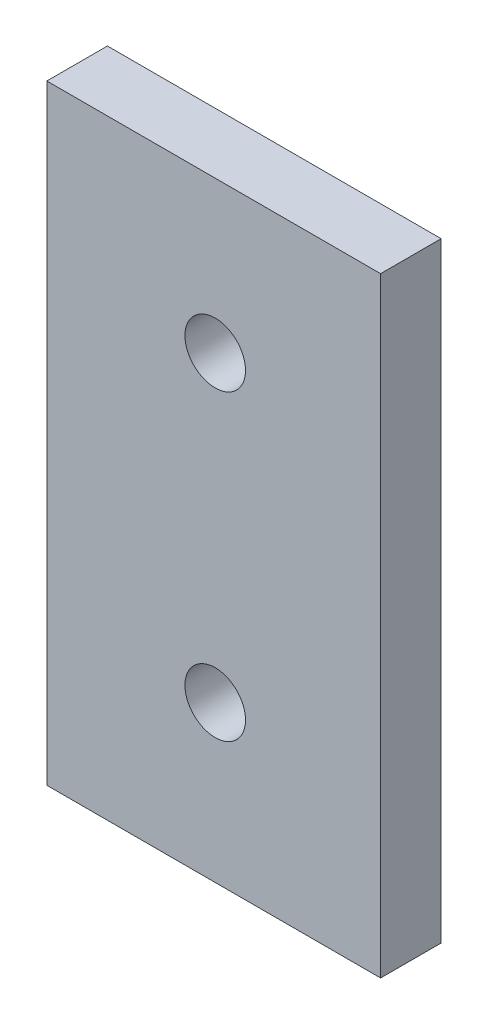
from build123d import *

# Parameters (mm, degrees)
SKETCH1_W           = 11.021644678
SKETCH1_H           = 20.145068856
SKETCH1_R           = 1
BOSS_EXTRUDE1_DEPTH = 2


with BuildPart() as part:
    # Sketch1 → Boss-Extrude1 (new body)
    with BuildSketch(Plane.XY):
        with Locations((5.510822339, 10.072534428)):
            Rectangle(SKETCH1_W, SKETCH1_H)
        with Locations((5.56, 15.145068856)):
            Circle(SKETCH1_R, mode=Mode.SUBTRACT)
        with Locations((5.56, 5.145068856)):
            Circle(SKETCH1_R, mode=Mode.SUBTRACT)
    extrude(amount=BOSS_EXTRUDE1_DEPTH)


solid = part.part
